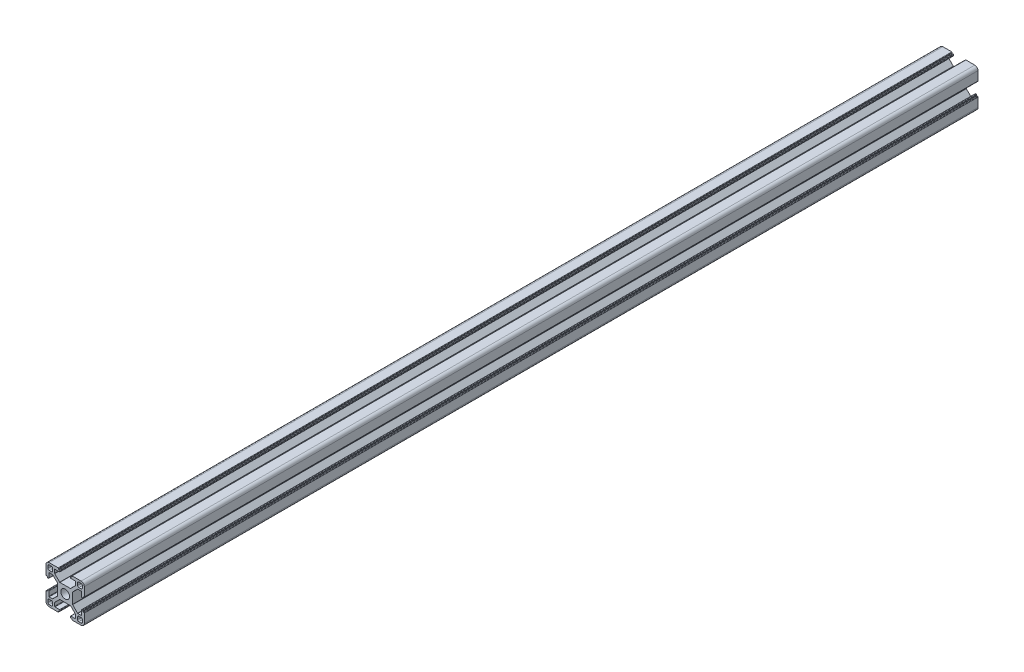
from build123d import *

# Parameters (mm, degrees)
MODEL_R             = 6.8
BOSS_EXTRUDE1_DEPTH = 1400
SCALE1_SCALE        = 0.5


with BuildPart() as part:
    # Model → Boss-Extrude1 (new body)
    with BuildSketch(Plane.XY):
        with BuildLine():
            Line((0, 11.6), (-8.240202025, 11.6))
            ThreePointArc((-8.240202025, 11.6), (-8.469812085, 11.64567228), (-8.664466094, 11.775735931))
            Line((-8.664466094, 11.775735931), (-16.324264069, 19.435533906))
            ThreePointArc((-16.324264069, 19.435533906), (-16.45432772, 19.630187915), (-16.5, 19.859797975))
            Line((-16.5, 19.859797975), (-16.5, 25))
            ThreePointArc((-16.5, 25), (-16.324264069, 25.424264069), (-15.9, 25.6))
            Line((-15.9, 25.6), (-8.8, 25.6))
            ThreePointArc((-8.8, 25.6), (-8.375735931, 25.775735931), (-8.2, 26.2))
            Line((-8.2, 26.2), (-8.2, 27.4))
            ThreePointArc((-8.2, 27.4), (-8.375735931, 27.824264069), (-8.8, 28))
            Line((-8.8, 28), (-9.8, 28))
            ThreePointArc((-9.8, 28), (-10.224264069, 28.175735931), (-10.4, 28.6))
            Line((-10.4, 28.6), (-10.4, 29.4))
            ThreePointArc((-10.4, 29.4), (-10.575735931, 29.824264069), (-10.999999999, 30))
            Line((-10.999999999, 30), (-25, 30))
            ThreePointArc((-25, 30), (-28.535533906, 28.535533906), (-30, 25))
            Line((-30, 25), (-30, 11))
            ThreePointArc((-30, 11), (-29.824264069, 10.575735931), (-29.4, 10.4))
            Line((-29.4, 10.4), (-28.6, 10.4))
            ThreePointArc((-28.6, 10.4), (-28.175735931, 10.224264069), (-28, 9.8))
            Line((-28, 9.8), (-28, 8.8))
            ThreePointArc((-28, 8.8), (-27.824264069, 8.375735931), (-27.4, 8.2))
            Line((-27.4, 8.2), (-26.2, 8.2))
            ThreePointArc((-26.2, 8.2), (-25.775735931, 8.375735931), (-25.6, 8.8))
            Line((-25.6, 8.8), (-25.6, 15.9))
            ThreePointArc((-25.6, 15.9), (-25.424264069, 16.324264069), (-25, 16.5))
            Line((-25, 16.5), (-19.859797974, 16.5))
            ThreePointArc((-19.859797974, 16.5), (-19.630187915, 16.454327719), (-19.435533906, 16.324264068))
            Line((-19.435533906, 16.324264068), (-11.775735931, 8.664466094))
            ThreePointArc((-11.775735931, 8.664466094), (-11.64567228, 8.469812085), (-11.6, 8.240202025))
            Line((-11.6, 8.240202025), (-11.6, 0))
            Line((-11.6, 0), (-11.6, -8.240202025))
            ThreePointArc((-11.6, -8.240202025), (-11.64567228, -8.469812085), (-11.775735931, -8.664466094))
            Line((-11.775735931, -8.664466094), (-19.435533906, -16.324264068))
            ThreePointArc((-19.435533906, -16.324264068), (-19.630187915, -16.454327719), (-19.859797974, -16.5))
            Line((-19.859797974, -16.5), (-25, -16.5))
            ThreePointArc((-25, -16.5), (-25.424264069, -16.324264069), (-25.6, -15.9))
            Line((-25.6, -15.9), (-25.6, -8.8))
            ThreePointArc((-25.6, -8.8), (-25.775735931, -8.375735931), (-26.2, -8.2))
            Line((-26.2, -8.2), (-27.4, -8.2))
            ThreePointArc((-27.4, -8.2), (-27.824264069, -8.375735931), (-28, -8.8))
            Line((-28, -8.8), (-28, -9.8))
            ThreePointArc((-28, -9.8), (-28.175735931, -10.224264069), (-28.6, -10.4))
            Line((-28.6, -10.4), (-29.4, -10.4))
            ThreePointArc((-29.4, -10.4), (-29.824264069, -10.575735931), (-30, -11))
            Line((-30, -11), (-30, -25))
            ThreePointArc((-30, -25), (-28.535533906, -28.535533906), (-25, -30))
            Line((-25, -30), (-10.999999999, -30))
            ThreePointArc((-10.999999999, -30), (-10.575735931, -29.824264069), (-10.4, -29.4))
            Line((-10.4, -29.4), (-10.4, -28.6))
            ThreePointArc((-10.4, -28.6), (-10.224264069, -28.175735931), (-9.8, -28))
            Line((-9.8, -28), (-8.8, -28))
            ThreePointArc((-8.8, -28), (-8.375735931, -27.824264069), (-8.2, -27.4))
            Line((-8.2, -27.4), (-8.2, -26.2))
            ThreePointArc((-8.2, -26.2), (-8.375735931, -25.775735931), (-8.8, -25.6))
            Line((-8.8, -25.6), (-15.9, -25.6))
            ThreePointArc((-15.9, -25.6), (-16.324264069, -25.424264069), (-16.5, -25))
            Line((-16.5, -25), (-16.5, -19.859797975))
            ThreePointArc((-16.5, -19.859797975), (-16.45432772, -19.630187915), (-16.324264069, -19.435533906))
            Line((-16.324264069, -19.435533906), (-8.664466094, -11.775735931))
            ThreePointArc((-8.664466094, -11.775735931), (-8.469812085, -11.64567228), (-8.240202025, -11.6))
            Line((-8.240202025, -11.6), (0, -11.6))
            Line((0, -11.6), (8.240202025, -11.6))
            ThreePointArc((8.240202025, -11.6), (8.469812085, -11.64567228), (8.664466094, -11.775735931))
            Line((8.664466094, -11.775735931), (16.324264069, -19.435533906))
            ThreePointArc((16.324264069, -19.435533906), (16.45432772, -19.630187915), (16.5, -19.859797975))
            Line((16.5, -19.859797975), (16.5, -25))
            ThreePointArc((16.5, -25), (16.324264069, -25.424264069), (15.9, -25.6))
            Line((15.9, -25.6), (8.8, -25.6))
            ThreePointArc((8.8, -25.6), (8.375735931, -25.775735931), (8.2, -26.2))
            Line((8.2, -26.2), (8.2, -27.4))
            ThreePointArc((8.2, -27.4), (8.375735931, -27.824264069), (8.8, -28))
            Line((8.8, -28), (9.8, -28))
            ThreePointArc((9.8, -28), (10.224264069, -28.175735931), (10.4, -28.6))
            Line((10.4, -28.6), (10.4, -29.4))
            ThreePointArc((10.4, -29.4), (10.575735931, -29.824264069), (10.999999999, -30))
            Line((10.999999999, -30), (25, -30))
            ThreePointArc((25, -30), (28.535533906, -28.535533906), (30, -25))
            Line((30, -25), (30, -11))
            ThreePointArc((30, -11), (29.824264069, -10.575735931), (29.4, -10.4))
            Line((29.4, -10.4), (28.6, -10.4))
            ThreePointArc((28.6, -10.4), (28.175735931, -10.224264069), (28, -9.8))
            Line((28, -9.8), (28, -8.8))
            ThreePointArc((28, -8.8), (27.824264069, -8.375735931), (27.4, -8.2))
            Line((27.4, -8.2), (26.2, -8.2))
            ThreePointArc((26.2, -8.2), (25.775735931, -8.375735931), (25.6, -8.8))
            Line((25.6, -8.8), (25.6, -15.9))
            ThreePointArc((25.6, -15.9), (25.424264069, -16.324264069), (25, -16.5))
            Line((25, -16.5), (19.859797974, -16.5))
            ThreePointArc((19.859797974, -16.5), (19.630187915, -16.454327719), (19.435533906, -16.324264068))
            Line((19.435533906, -16.324264068), (11.775735931, -8.664466094))
            ThreePointArc((11.775735931, -8.664466094), (11.64567228, -8.469812085), (11.6, -8.240202025))
            Line((11.6, -8.240202025), (11.6, 0))
            Line((11.6, 0), (11.6, 8.240202025))
            ThreePointArc((11.6, 8.240202025), (11.64567228, 8.469812085), (11.775735931, 8.664466094))
            Line((11.775735931, 8.664466094), (19.611269837, 16.5))
            Line((19.611269837, 16.5), (25, 16.5))
            ThreePointArc((25, 16.5), (25.424264069, 16.324264069), (25.6, 15.9))
            Line((25.6, 15.9), (25.6, 8.8))
            ThreePointArc((25.6, 8.8), (25.775735931, 8.375735931), (26.2, 8.2))
            Line((26.2, 8.2), (27.4, 8.2))
            ThreePointArc((27.4, 8.2), (27.824264069, 8.375735931), (28, 8.8))
            Line((28, 8.8), (28, 9.8))
            ThreePointArc((28, 9.8), (28.175735931, 10.224264069), (28.6, 10.4))
            Line((28.6, 10.4), (29.4, 10.4))
            ThreePointArc((29.4, 10.4), (29.824264069, 10.575735931), (30, 11))
            Line((30, 11), (30, 25))
            ThreePointArc((30, 25), (28.535533906, 28.535533906), (25, 30))
            Line((25, 30), (10.999999999, 30))
            ThreePointArc((10.999999999, 30), (10.575735931, 29.824264069), (10.4, 29.4))
            Line((10.4, 29.4), (10.4, 28.6))
            ThreePointArc((10.4, 28.6), (10.224264069, 28.175735931), (9.8, 28))
            Line((9.8, 28), (8.8, 28))
            ThreePointArc((8.8, 28), (8.375735931, 27.824264069), (8.2, 27.4))
            Line((8.2, 27.4), (8.2, 26.2))
            ThreePointArc((8.2, 26.2), (8.375735931, 25.775735931), (8.8, 25.6))
            Line((8.8, 25.6), (15.9, 25.6))
            ThreePointArc((15.9, 25.6), (16.324264069, 25.424264069), (16.5, 25))
            Line((16.5, 25), (16.5, 19.859797975))
            ThreePointArc((16.5, 19.859797975), (16.45432772, 19.630187915), (16.324264069, 19.435533906))
            Line((16.324264069, 19.435533906), (8.664466094, 11.775735931))
            ThreePointArc((8.664466094, 11.775735931), (8.469812085, 11.64567228), (8.240202025, 11.6))
            Line((8.240202025, 11.6), (0, 11.6))
        make_face()
        Circle(MODEL_R, mode=Mode.SUBTRACT)
        with BuildLine():
            Line((21.5, 27), (25, 27))
            ThreePointArc((25, 27), (26.414213562, 26.414213562), (27, 25))
            Line((27, 25), (27, 21.5))
            ThreePointArc((27, 21.5), (26.414213562, 20.085786438), (25, 19.5))
            Line((25, 19.5), (21.5, 19.5))
            ThreePointArc((21.5, 19.5), (20.085786438, 20.085786438), (19.5, 21.5))
            Line((19.5, 21.5), (19.5, 25))
            ThreePointArc((19.5, 25), (20.085786438, 26.414213562), (21.5, 27))
        make_face(mode=Mode.SUBTRACT)
        with BuildLine():
            Line((21.5, -27), (25, -27))
            ThreePointArc((25, -27), (26.414213562, -26.414213562), (27, -25))
            Line((27, -25), (27, -21.5))
            ThreePointArc((27, -21.5), (26.414213562, -20.085786438), (25, -19.5))
            Line((25, -19.5), (21.5, -19.5))
            ThreePointArc((21.5, -19.5), (20.085786438, -20.085786438), (19.5, -21.5))
            Line((19.5, -21.5), (19.5, -25))
            ThreePointArc((19.5, -25), (20.085786438, -26.414213562), (21.5, -27))
        make_face(mode=Mode.SUBTRACT)
        with BuildLine():
            Line((-21.5, -27), (-25, -27))
            ThreePointArc((-25, -27), (-26.414213562, -26.414213562), (-27, -25))
            Line((-27, -25), (-27, -21.5))
            ThreePointArc((-27, -21.5), (-26.414213562, -20.085786438), (-25, -19.5))
            Line((-25, -19.5), (-21.5, -19.5))
            ThreePointArc((-21.5, -19.5), (-20.085786438, -20.085786438), (-19.5, -21.5))
            Line((-19.5, -21.5), (-19.5, -25))
            ThreePointArc((-19.5, -25), (-20.085786438, -26.414213562), (-21.5, -27))
        make_face(mode=Mode.SUBTRACT)
        with BuildLine():
            Line((-21.5, 27), (-25, 27))
            ThreePointArc((-25, 27), (-26.414213562, 26.414213562), (-27, 25))
            Line((-27, 25), (-27, 21.5))
            ThreePointArc((-27, 21.5), (-26.414213562, 20.085786438), (-25, 19.5))
            Line((-25, 19.5), (-21.5, 19.5))
            ThreePointArc((-21.5, 19.5), (-20.085786438, 20.085786438), (-19.5, 21.5))
            Line((-19.5, 21.5), (-19.5, 25))
            ThreePointArc((-19.5, 25), (-20.085786438, 26.414213562), (-21.5, 27))
        make_face(mode=Mode.SUBTRACT)
    extrude(amount=BOSS_EXTRUDE1_DEPTH)


with BuildPart() as part_1:
    # Scale1: scaled about (-0.000116359, -9.761e-05, 700)
    add(part.part.scale(SCALE1_SCALE).moved(Location((-5.818e-05, -4.8805e-05, 350))))


solid = part_1.part
